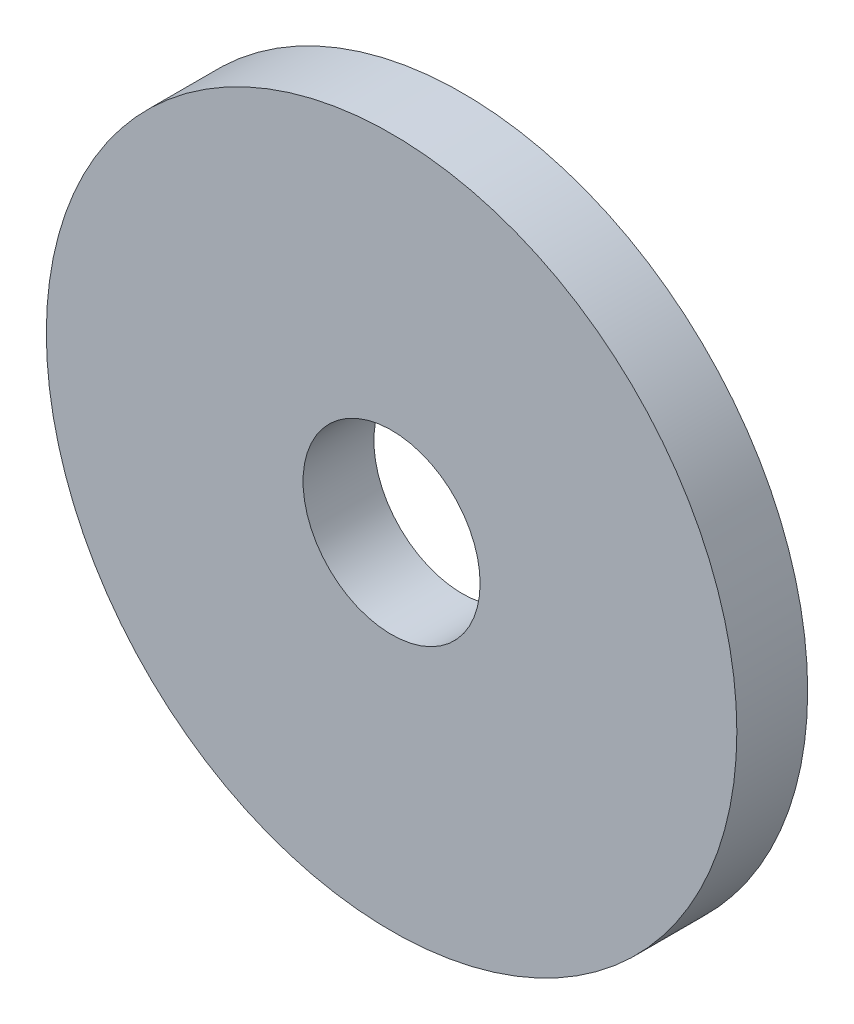
from build123d import *

# Parameters (mm, degrees)
SKETCH_1_R      = 5.85
SKETCH_1_R_2    = 1.5
EXTRUDE_1_DEPTH = 1.2


with BuildPart() as part:
    # 草图1 → 凸台-拉伸1 (new body)
    with BuildSketch(Plane.XY):
        Circle(SKETCH_1_R)
        Circle(SKETCH_1_R_2, mode=Mode.SUBTRACT)
    extrude(amount=EXTRUDE_1_DEPTH)


solid = part.part
